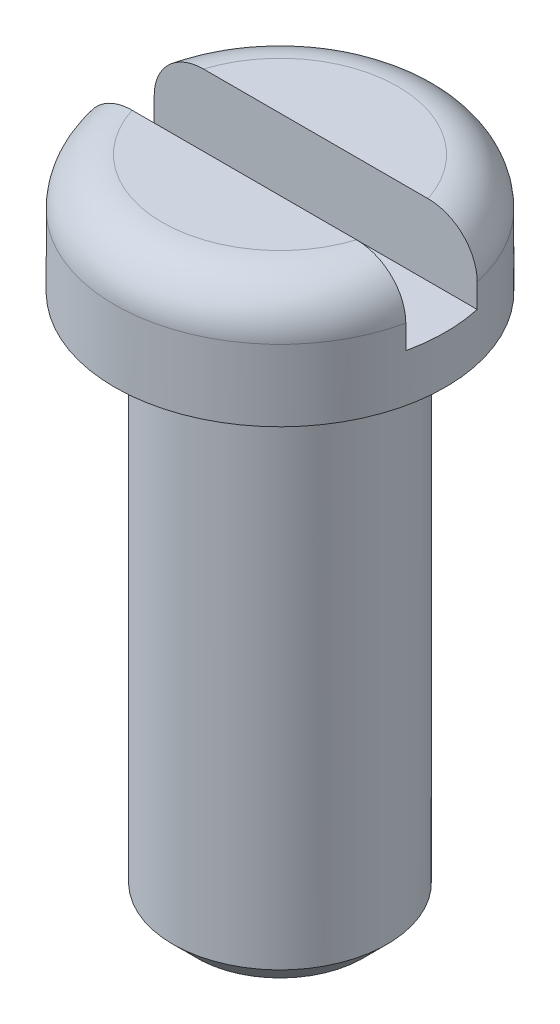
from build123d import *

# Parameters (mm, degrees)
SKETCH_1_R          = 1.39
EXTRUDE_1_DEPTH     = 1
SKETCH_2_W          = 2.78
SKETCH_2_H          = 0.6
CUT_EXTRUDE_1_DEPTH = 0.6
FILLET_2_R          = 0.4
SKETCH_3_R          = 0.9
EXTRUDE_2_DEPTH     = 4.5
CHAMFER_1_SIZE      = 0.2


with BuildPart() as part:
    # Эскиз1 → Бобышка-Вытянуть1 (new body)
    with BuildSketch(Plane(origin=(0, 0, 0), x_dir=(1, 0, 0), z_dir=(0, 1, 0))):
        with Locations(Location((0, 0, 0), (0, 0, 270))):
            Circle(SKETCH_1_R)
    extrude(amount=EXTRUDE_1_DEPTH)

    # Эскиз2 → Вырез-Вытянуть1 (cut)
    with BuildSketch(Plane(origin=(0, 1, 0), x_dir=(1, 0, 0), z_dir=(0, 1, 0))):
        Rectangle(SKETCH_2_W, SKETCH_2_H)
    extrude(amount=-CUT_EXTRUDE_1_DEPTH, mode=Mode.SUBTRACT)

    # Скругление2
    fillet_2_edges = [part.edges().sort_by_distance(p)[0] for p in [
        (0, 1, -1.39),
        (0.870373483, 1, 1.08376658),
    ]]
    fillet(fillet_2_edges, radius=FILLET_2_R)

    # Эскиз3 → Бобышка-Вытянуть2 (add)
    with BuildSketch(Plane.XZ):
        with Locations(Location((0, 0, 0), (0, 0, 90))):
            Circle(SKETCH_3_R)
    extrude(amount=EXTRUDE_2_DEPTH)

    # Фаска1
    chamfer_1_edges = [part.edges().sort_by_distance(p)[0] for p in [
        (0, -4.5, -0.9),
    ]]
    chamfer(chamfer_1_edges, length=CHAMFER_1_SIZE)


solid = part.part
